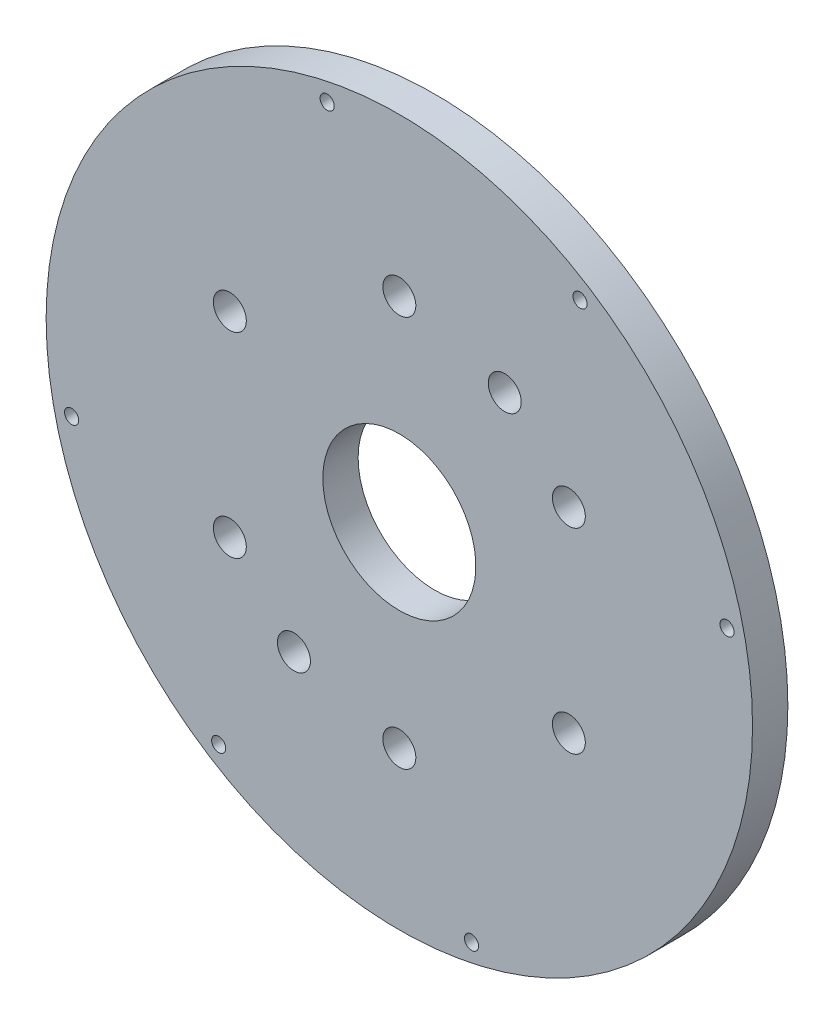
from build123d import *

# Parameters (mm, degrees)
SKETCH1_R                      = 60
BOSS_EXTRUDE1_DEPTH            = 6
CUT_EXTRUDE1_DEPTH             = 86.064681273
CUT_EXTRUDE1_DEPTH_BACK        = 86.064681273
SKETCH2_R                      = 13
F_4_0MM_DOWEL_HOLE1_D          = 5.6
F_1_0MM_DOWEL_HOLE1_D          = 5.6
CBORE_FOR_M2_SHCS3_D           = 2.4
CBORE_FOR_M2_SHCS3_CBORE_D     = 4.4
CBORE_FOR_M2_SHCS3_CBORE_DEPTH = 2


with BuildPart() as part:
    # Sketch1 → Boss-Extrude1 (new body)
    with BuildSketch(Plane.XY):
        Circle(SKETCH1_R)
    extrude(amount=-BOSS_EXTRUDE1_DEPTH)

    # Sketch2 → Cut-Extrude1 (cut, two sides: drawn at the far end of the back side and taken through both)
    with BuildSketch(Plane(origin=(0, 0, -6), x_dir=(-1, 0, 0), z_dir=(0, 0, -1)).offset(-CUT_EXTRUDE1_DEPTH_BACK)):
        Circle(SKETCH2_R)
    extrude(amount=CUT_EXTRUDE1_DEPTH + CUT_EXTRUDE1_DEPTH_BACK, mode=Mode.SUBTRACT)

    # Ø4.0mm Dowel Hole1 (through all)
    with Locations(Plane(origin=(0, 0, -6), x_dir=(-1, 0, 0), z_dir=(0, 0, -1))):
        with Locations((0, 0), (0, -33.25), (-28.795344676, -16.625), (-28.795344676, 16.625), (0, 33.25), (28.795344676, 16.625), (28.795344676, -16.625)):
            Hole(F_4_0MM_DOWEL_HOLE1_D / 2)

    # Ø1.0mm Dowel Hole1 (through all)
    with Locations(Plane.XY):
        with Locations((17.903184603, 28.018538168), (-17.903184603, -28.018538168)):
            Hole(F_1_0MM_DOWEL_HOLE1_D / 2)

    # CBORE for M2 SHCS3 (through all)
    with Locations(Plane(origin=(0, 0, -6), x_dir=(-1, 0, 0), z_dir=(0, 0, -1))):
        with Locations((-55.665534129, 12.261660172), (-30.691173604, 48.031779717), (12.261660172, 55.665534129), (55.665534129, -12.261660172), (30.691173604, -48.031779717), (-12.261660172, -55.665534129)):
            CounterBoreHole(CBORE_FOR_M2_SHCS3_D / 2, CBORE_FOR_M2_SHCS3_CBORE_D / 2, CBORE_FOR_M2_SHCS3_CBORE_DEPTH)


solid = part.part
